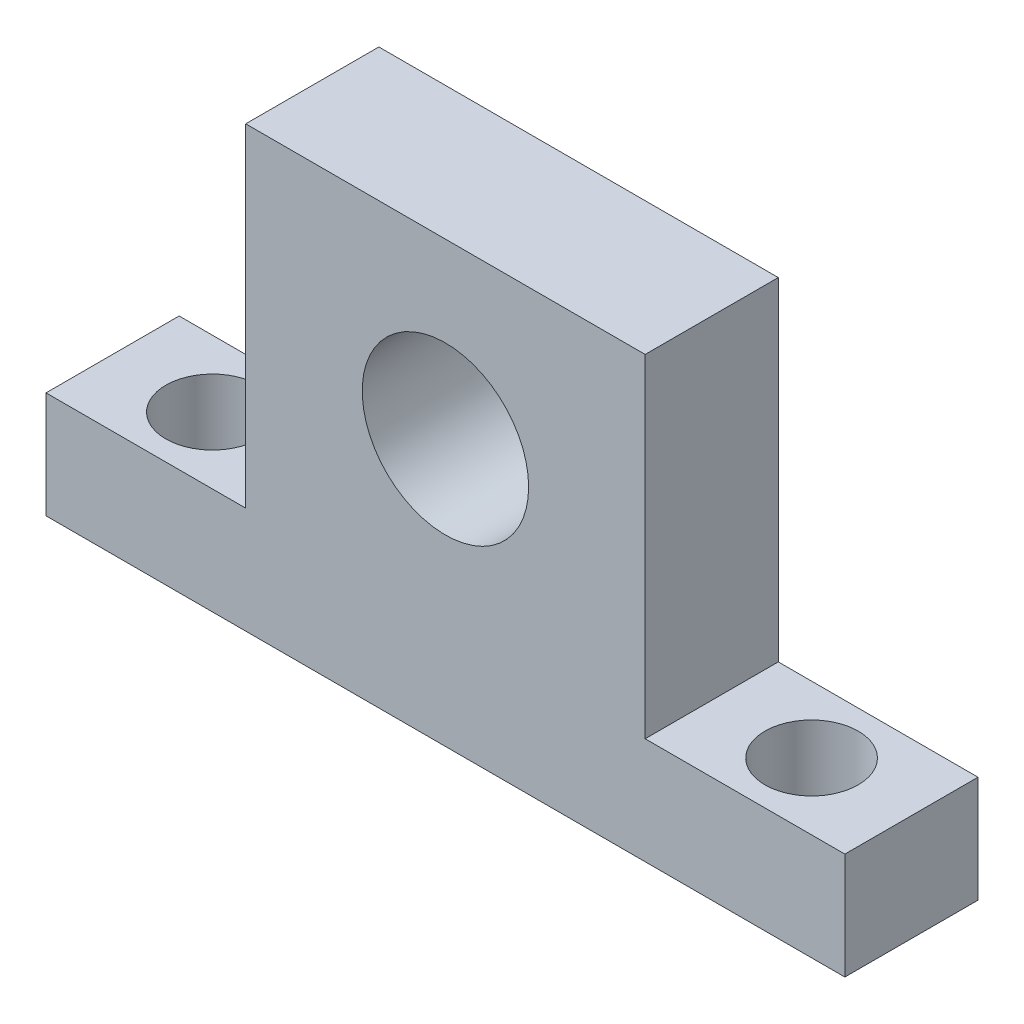
from build123d import *

# Parameters (mm, degrees)
SKETCH_1_R          = 6.25
EXTRUDE_1_DEPTH     = 10
SKETCH_2_R          = 3.5
CUT_EXTRUDE_2_DEPTH = 53.440442409
SKETCH_3_R          = 3.5
CUT_EXTRUDE_3_DEPTH = 53.440442409


with BuildPart() as part:
    # 草圖1 → 填料-伸長1 (new body)
    with BuildSketch(Plane.XY):
        Polygon((30, 0), (45, 0), (45, -8), (-15, -8), (-15, 0), (0, 0), (0, 25), (30, 25), align=None)
        with Locations((15, 12)):
            Circle(SKETCH_1_R, mode=Mode.SUBTRACT)
    extrude(amount=EXTRUDE_1_DEPTH)

    # 草圖2 → 除料-伸長2 (cut, through all)
    with BuildSketch(Plane(origin=(0, 0, 0), x_dir=(1, 0, 0), z_dir=(0, 1, 0))):
        with Locations(Location((37.5, -5, 0), (0, 0, 270))):
            Circle(SKETCH_2_R)
    extrude(amount=-CUT_EXTRUDE_2_DEPTH, mode=Mode.SUBTRACT)

    # 草圖3 → 除料-伸長3 (cut, through all)
    with BuildSketch(Plane(origin=(0, 0, 0), x_dir=(1, 0, 0), z_dir=(0, 1, 0))):
        with Locations(Location((-7.5, -5, 0), (0, 0, 270))):
            Circle(SKETCH_3_R)
    extrude(amount=-CUT_EXTRUDE_3_DEPTH, mode=Mode.SUBTRACT)


solid = part.part
